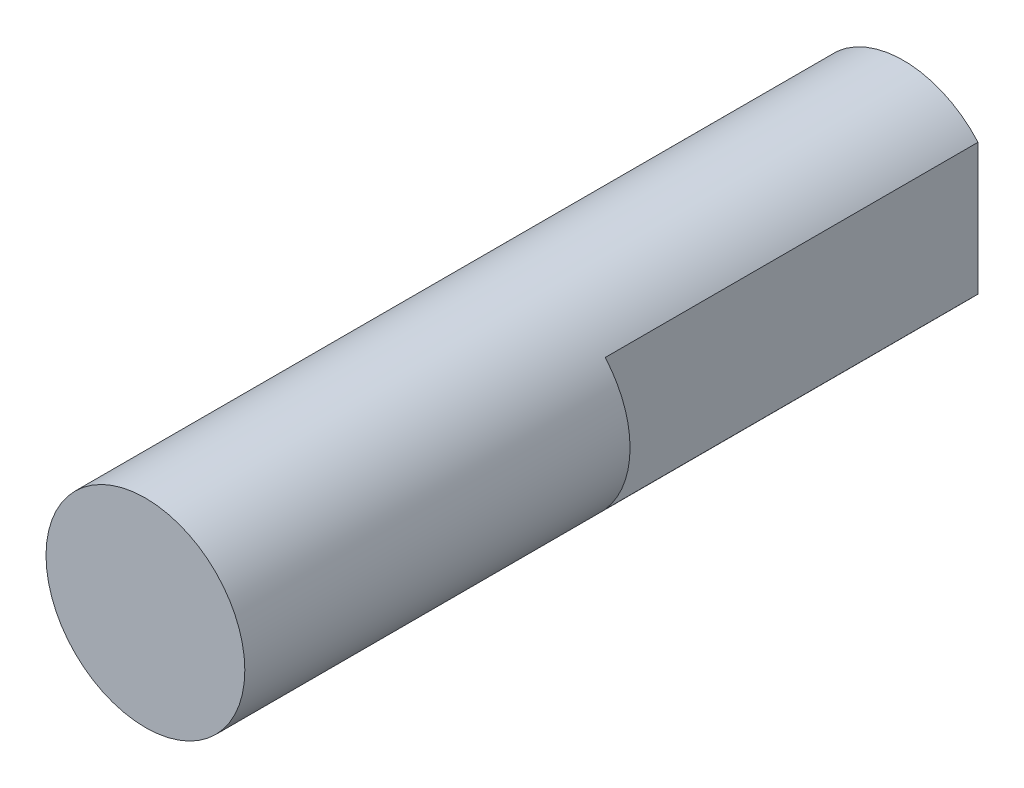
from build123d import *

# Parameters (mm, degrees)
EXTRUDE_1_DEPTH      = 10
EXTRUDE_1_DEPTH_BACK = 20.5
SKETCH_1_R           = 4
CUT_EXTRUDE_1_DEPTH  = 15


with BuildPart() as part:
    # 스케치1 → 보스-돌출1 (new, two sides: drawn at the far end of the back side and taken through both)
    with BuildSketch(Plane.XY.offset(-EXTRUDE_1_DEPTH_BACK)):
        Circle(SKETCH_1_R)
    extrude(amount=EXTRUDE_1_DEPTH + EXTRUDE_1_DEPTH_BACK)

    # 스케치3 → 컷-돌출1 (cut)
    with BuildSketch(Plane(origin=(0, 0, -20.5), x_dir=(-1, 0, 0), z_dir=(0, 0, -1))):
        with BuildLine():
            Line((-3, 2.645751311), (-3, -2.645751311))
            ThreePointArc((-3, -2.645751311), (-4, 0), (-3, 2.645751311))
        make_face()
    extrude(amount=-CUT_EXTRUDE_1_DEPTH, mode=Mode.SUBTRACT)


solid = part.part
